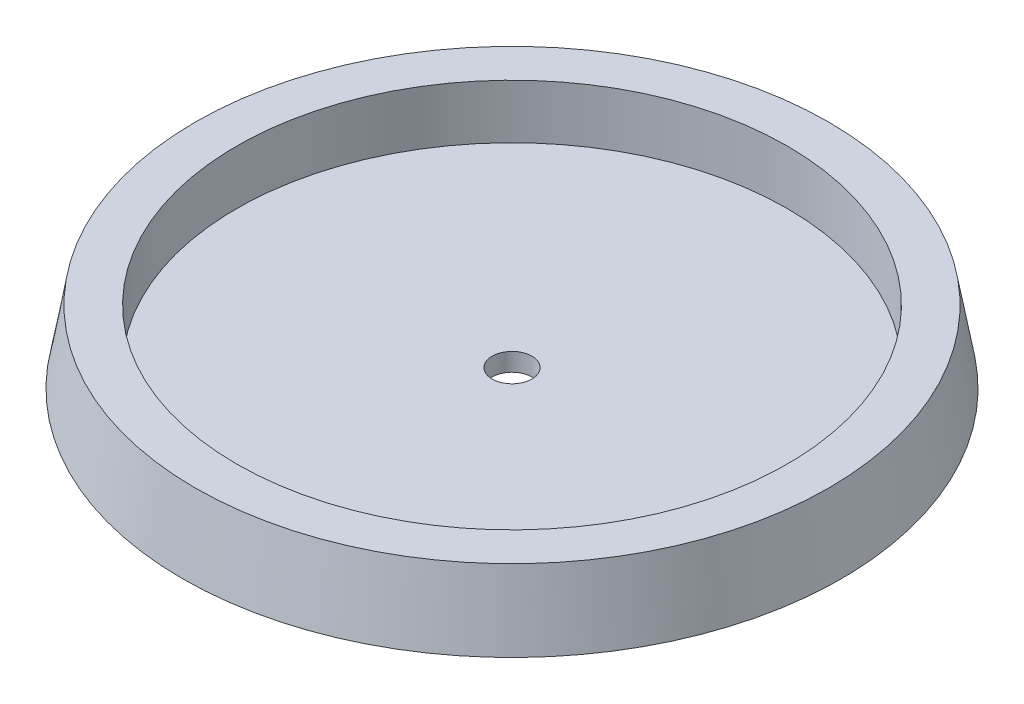
from build123d import *

# Parameters (mm, degrees)
SKETCH1_R           = 18.25
BOSS_EXTRUDE1_DEPTH = 4
BOSS_EXTRUDE1_TAPER = 10
CUT_EXTRUDE2_START  = 4
SKETCH1_5_R         = 1.1
CUT_EXTRUDE2_DEPTH  = 4
CUT_EXTRUDE3_START  = 4
SKETCH1_6_R         = 15.25
CUT_EXTRUDE3_DEPTH  = 3


with BuildPart() as part:
    # Sketch1 → Boss-Extrude1 (new body)
    with BuildSketch(Plane(origin=(0, 0, 0), x_dir=(1, 0, 0), z_dir=(0, 1, 0))):
        Circle(SKETCH1_R)
    extrude(amount=BOSS_EXTRUDE1_DEPTH, taper=BOSS_EXTRUDE1_TAPER)

    # Sketch1<5> → Cut-Extrude2 (cut)
    with BuildSketch(Plane(origin=(0, 0, 0), x_dir=(1, 0, 0), z_dir=(0, 1, 0)).offset(CUT_EXTRUDE2_START)):
        with Locations(Location((0, 0, 0), (0, 0, 270))):
            Circle(SKETCH1_5_R)
    extrude(amount=-CUT_EXTRUDE2_DEPTH, mode=Mode.SUBTRACT)

    # Sketch1<6> → Cut-Extrude3 (cut)
    with BuildSketch(Plane(origin=(0, 0, 0), x_dir=(1, 0, 0), z_dir=(0, 1, 0)).offset(CUT_EXTRUDE3_START)):
        with Locations(Location((0, 0, 0), (0, 0, 270))):
            Circle(SKETCH1_6_R)
    extrude(amount=-CUT_EXTRUDE3_DEPTH, mode=Mode.SUBTRACT)


solid = part.part
